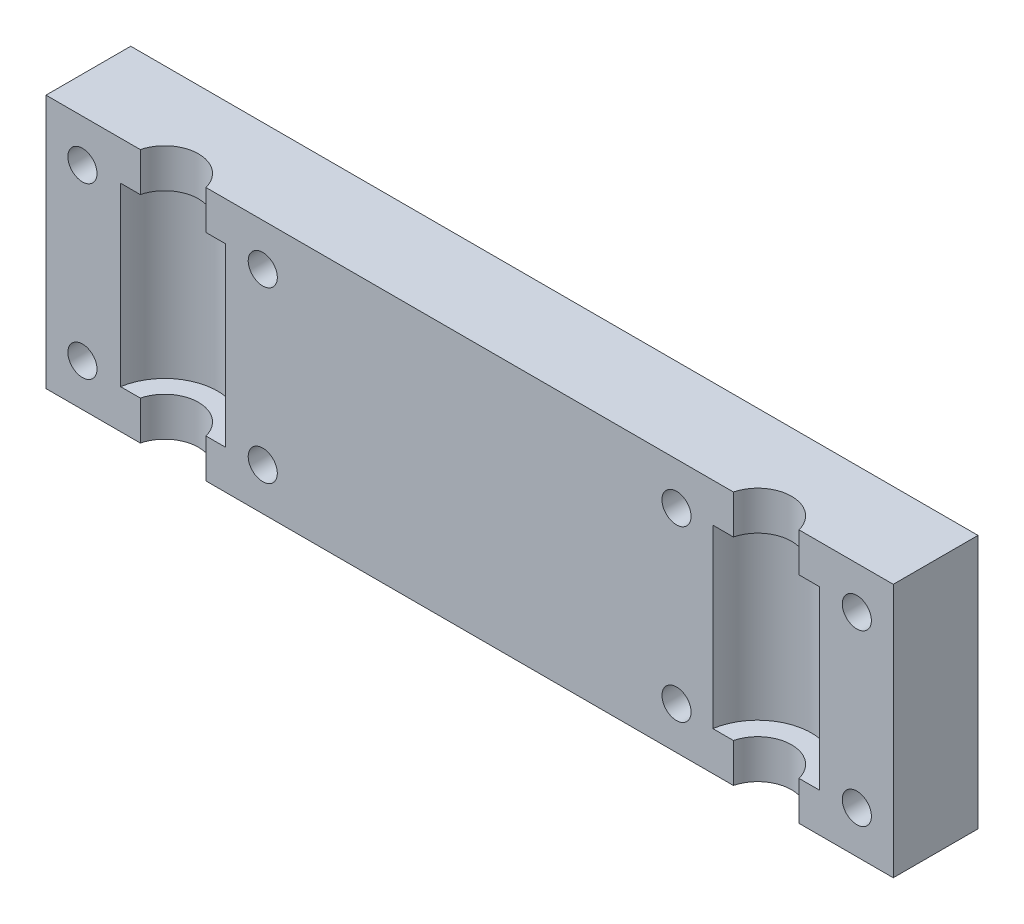
from build123d import *

# Parameters (mm, degrees)
SKETCH1_W                                      = 127
SKETCH1_H                                      = 12.7
BOSS_EXTRUDE1_DEPTH                            = 38.1
SKETCH3_R                                      = 4.445
CUT_EXTRUDE3_DEPTH                             = 2.54
CUT_EXTRUDE4_DEPTH                             = 13.208
CUT_EXTRUDE4_DEPTH_BACK                        = 13.208
SKETCH2_R                                      = 7.9756
SKETCH2_R_2                                    = 8.1026
SKETCH6_R                                      = 5.08
CUT_EXTRUDE5_DEPTH                             = 38.1
F_11_64_0_17188_DIAMETER_HOLE1_D               = 4.365752
F_11_64_0_17188_DIAMETER_HOLE1_DEPTH           = 25.4
F_11_64_0_17188_DIAMETER_HOLE1_TIP             = 1.311604225
F_11_64_0_17188_DIAMETER_HOLE1_ON_FACE_2_D     = 4.365752
F_11_64_0_17188_DIAMETER_HOLE1_ON_FACE_2_DEPTH = 25.4
F_11_64_0_17188_DIAMETER_HOLE1_ON_FACE_2_TIP   = 1.311604225


with BuildPart() as part:
    # Sketch1 → Boss-Extrude1 (new body)
    with BuildSketch(Plane(origin=(0, 0, 0), x_dir=(1, 0, 0), z_dir=(0, 1, 0))):
        with Locations((0, -6.35)):
            Rectangle(SKETCH1_W, SKETCH1_H)
    extrude(amount=BOSS_EXTRUDE1_DEPTH)

    # Sketch3 → Cut-Extrude3 (cut)
    with BuildSketch(Plane(origin=(0, 0, 0), x_dir=(-1, 0, 0), z_dir=(0, 0, -1))):
        with Locations((-58.039, 31.75)):
            Circle(SKETCH3_R)
        with Locations((-58.039, 6.35)):
            Circle(SKETCH3_R)
        with Locations((-31.009232106, 31.75)):
            Circle(SKETCH3_R)
        with Locations((-31.009232106, 6.35)):
            Circle(SKETCH3_R)
        with Locations((31.009232106, 31.75)):
            Circle(SKETCH3_R)
        with Locations((31.009232106, 6.35)):
            Circle(SKETCH3_R)
        with Locations((58.039, 31.75)):
            Circle(SKETCH3_R)
        with Locations((58.039, 6.35)):
            Circle(SKETCH3_R)
    extrude(amount=-CUT_EXTRUDE3_DEPTH, mode=Mode.SUBTRACT)

    # Sketch2 → Cut-Extrude4 (cut, two sides: drawn at the far end of the back side and taken through both)
    with BuildSketch(Plane(origin=(0, 19.05, 0), x_dir=(1, 0, 0), z_dir=(0, 1, 0)).offset(-CUT_EXTRUDE4_DEPTH_BACK)):
        with Locations((-44.45, -13.97)):
            Circle(SKETCH2_R)
        with Locations((44.45, -13.97)):
            Circle(SKETCH2_R_2)
    extrude(amount=CUT_EXTRUDE4_DEPTH + CUT_EXTRUDE4_DEPTH_BACK, mode=Mode.SUBTRACT)

    # Sketch6 → Cut-Extrude5 (cut)
    with BuildSketch(Plane(origin=(0, 38.1, 0), x_dir=(1, 0, 0), z_dir=(0, 1, 0))):
        with Locations((-44.45, -13.97)):
            Circle(SKETCH6_R)
        with Locations((44.45, -13.97)):
            Circle(SKETCH6_R)
    extrude(amount=-CUT_EXTRUDE5_DEPTH, mode=Mode.SUBTRACT)

    # 11/64 (0.17188) Diameter Hole1
    with Locations(Plane(origin=(58.039, 31.75, 0), x_dir=(-1, 0, 0), z_dir=(0, 0, -1))):
        with Locations((0, 0), (27.029767894, 0), (27.029767894, -25.4), (89.048232106, -25.4), (116.078, 0)):
            Hole(F_11_64_0_17188_DIAMETER_HOLE1_D / 2, depth=F_11_64_0_17188_DIAMETER_HOLE1_DEPTH)
            with Locations((0, 0, -(F_11_64_0_17188_DIAMETER_HOLE1_DEPTH + F_11_64_0_17188_DIAMETER_HOLE1_TIP / 2))):  # 118° drill point
                Cone(0, F_11_64_0_17188_DIAMETER_HOLE1_D / 2, F_11_64_0_17188_DIAMETER_HOLE1_TIP, mode=Mode.SUBTRACT)

    # 11/64 (0.17188) Diameter Hole1 on face 2
    with Locations(Plane(origin=(58.039, 6.35, 2.54), x_dir=(-1, 0, 0), z_dir=(0, 0, -1))):
        with Locations((0, 0), (89.048232106, 25.4), (116.078, 0)):
            Hole(F_11_64_0_17188_DIAMETER_HOLE1_ON_FACE_2_D / 2, depth=F_11_64_0_17188_DIAMETER_HOLE1_ON_FACE_2_DEPTH)
            with Locations((0, 0, -(F_11_64_0_17188_DIAMETER_HOLE1_ON_FACE_2_DEPTH + F_11_64_0_17188_DIAMETER_HOLE1_ON_FACE_2_TIP / 2))):  # 118° drill point
                Cone(0, F_11_64_0_17188_DIAMETER_HOLE1_ON_FACE_2_D / 2, F_11_64_0_17188_DIAMETER_HOLE1_ON_FACE_2_TIP, mode=Mode.SUBTRACT)


solid = part.part
